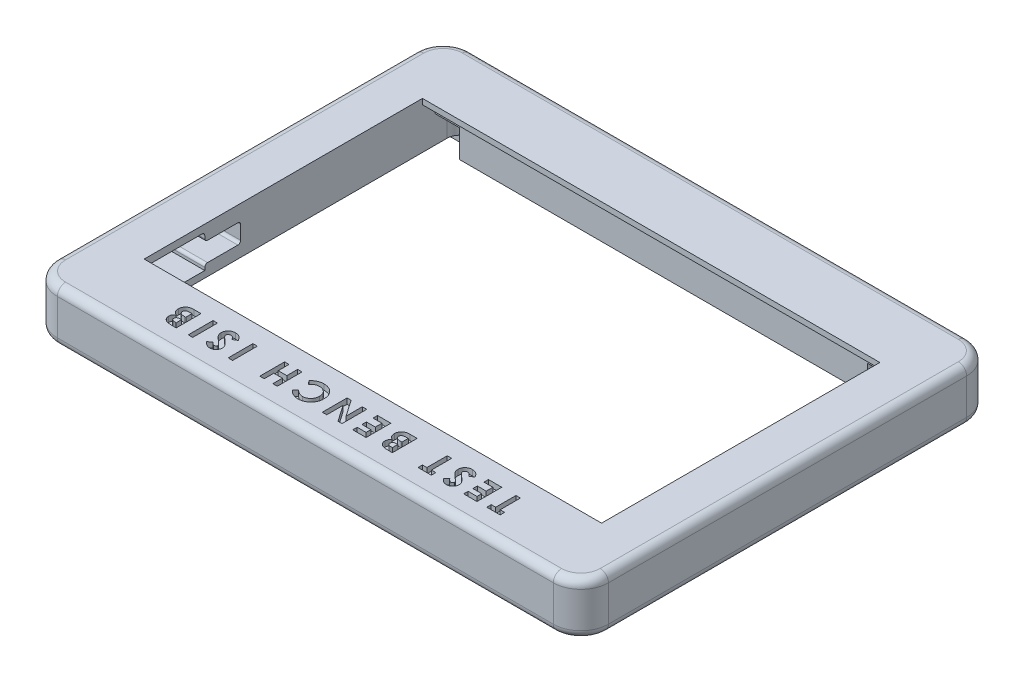
from build123d import *

# Parameters (mm, degrees)
BOSS_EXTRU_1_DEPTH        = 19
ESQUISSE3_W               = 170.2
ESQUISSE3_H               = 125
ENL_V_MAT_EXTRU_2_DEPTH   = 2
ESQUISSE2_W               = 166
ESQUISSE2_H               = 101
ENL_V_MAT_EXTRU_1_DEPTH   = 17
ENL_V_MAT_EXTRU_3_DEPTH   = 10
TROU_TARAUD_M3X0_51_D     = 2.5
TROU_TARAUD_M3X0_51_DEPTH = 11
TROU_TARAUD_M3X0_51_TIP   = 0.751075774
ESQUISSE9_W               = 1.614636752
ESQUISSE9_H               = 8.995833333
ENL_V_MAT_EXTRU_5_DEPTH   = 2
CONG_1_R                  = 3
ENL_V_MAT_EXTRU_6_REACH   = 200.683
ENL_V_MAT_EXTRU_7_DEPTH   = 5


with BuildPart() as part:
    # Esquisse1 → Boss.-Extru.1 (new body)
    with BuildSketch(Plane(origin=(0, 0, 0), x_dir=(1, 0, 0), z_dir=(0, 1, 0))):
        with BuildLine():
            Line((-90, 75), (90, 75))
            ThreePointArc((90, 75), (97.071067812, 72.071067812), (100, 65))
            Line((100, 65), (100, -65))
            ThreePointArc((100, -65), (97.071067812, -72.071067812), (90, -75))
            Line((90, -75), (-90, -75))
            ThreePointArc((-90, -75), (-97.071067812, -72.071067812), (-100, -65))
            Line((-100, -65), (-100, 65))
            ThreePointArc((-100, 65), (-97.071067812, 72.071067812), (-90, 75))
        make_face()
    extrude(amount=BOSS_EXTRU_1_DEPTH)

    # Esquisse3 → Enlèv. mat.-Extru.2 (cut)
    with BuildSketch(Plane.XZ):
        Rectangle(ESQUISSE3_W, ESQUISSE3_H)
    extrude(amount=-ENL_V_MAT_EXTRU_2_DEPTH, mode=Mode.SUBTRACT)

    # Esquisse2 → Enlèv. mat.-Extru.1 (cut)
    with BuildSketch(Plane(origin=(0, 19, 0), x_dir=(1, 0, 0), z_dir=(0, 1, 0))):
        Rectangle(ESQUISSE2_W, ESQUISSE2_H)
    extrude(amount=-ENL_V_MAT_EXTRU_1_DEPTH, mode=Mode.SUBTRACT)

    # Esquisse4 → Enlèv. mat.-Extru.3 (cut)
    with BuildSketch(Plane.XZ.offset(-2)):
        with BuildLine():
            Line((-83, -55), (-83, -59.5))
            ThreePointArc((-83, -59.5), (-78.5, -64), (-74, -59.5))
            Line((-74, -59.5), (-74, -55))
            Line((-74, -55), (74, -55))
            Line((74, -55), (74, -59.5))
            ThreePointArc((74, -59.5), (78.5, -64), (83, -59.5))
            Line((83, -59.5), (83, -55))
            Line((83, -55), (83, 52.5))
            Line((83, 52.5), (83, 57))
            ThreePointArc((83, 57), (78.5, 61.5), (74, 57))
            Line((74, 57), (74, 52.5))
            Line((74, 52.5), (-74, 52.5))
            Line((-74, 52.5), (-74, 57))
            ThreePointArc((-74, 57), (-78.5, 61.5), (-83, 57))
            Line((-83, 57), (-83, 52.5))
            Line((-83, 52.5), (-83, -55))
        make_face()
    extrude(amount=-ENL_V_MAT_EXTRU_3_DEPTH, mode=Mode.SUBTRACT)

    # Trou taraudé M3x0.51
    with Locations(Plane(origin=(0, 2, 0), x_dir=(-1, 0, 0), z_dir=(0, -1, 0))):
        with Locations((68.1, -59.2), (-68.1, -59.2), (-68.1, 59.2), (68.1, 59.2)):
            Hole(TROU_TARAUD_M3X0_51_D / 2, depth=TROU_TARAUD_M3X0_51_DEPTH)
            with Locations((0, 0, -(TROU_TARAUD_M3X0_51_DEPTH + TROU_TARAUD_M3X0_51_TIP / 2))):  # 118° drill point
                Cone(0, TROU_TARAUD_M3X0_51_D / 2, TROU_TARAUD_M3X0_51_TIP, mode=Mode.SUBTRACT)

    # Esquisse9 → Enlèv. mat.-Extru.5 (cut)
    # profile 1 of 13: a face of its own
    with BuildSketch(Plane(origin=(0, 19, 0), x_dir=(1, 0, 0), z_dir=(0, 1, 0))):
        with BuildLine():
            Line((-55.543504274, -57.318163919), (-55.543504274, -66.313997252))
            Line((-55.543504274, -66.313997252), (-56.985144231, -66.313997252))
            add(Edge.make_bspline(
                [(-56.985144231, -66.313997252), (-57.086068222, -66.31401103), (-57.281354231, -66.314037689), (-57.563098062, -66.304113358), (-57.823803469, -66.291445734), (-58.06378861, -66.276797649), (-58.282964639, -66.252487411), (-58.481482505, -66.226325004), (-58.65860696, -66.194983204), (-58.768112049, -66.166850461), (-58.819631076, -66.153614807)],
                knots=[0, 0, 0, 0, 1.311970222, 2.538637508, 3.664491357, 4.705491327, 5.663608299, 6.530571107, 7.308675535, 8, 8, 8, 8], degree=3))
            add(Edge.make_bspline(
                [(-58.819631076, -66.153614807), (-58.887280332, -66.134946334), (-59.020029888, -66.098312798), (-59.210179644, -66.024343182), (-59.390524584, -65.942070688), (-59.56102527, -65.848395845), (-59.719665235, -65.741571618), (-59.868619093, -65.623635486), (-60.007193969, -65.494547587), (-60.133181027, -65.353543067), (-60.246897462, -65.204336052), (-60.346107055, -65.046856999), (-60.431802102, -64.883601817), (-60.49760381, -64.711752985), (-60.552860568, -64.535798436), (-60.589828518, -64.352164176), (-60.614633195, -64.162432091), (-60.616917421, -64.033284972), (-60.618076923, -63.967728222)],
                knots=[0, 0, 0, 0, 1.099879008, 2.158315707, 3.195196496, 4.207130292, 5.205157476, 6.190838564, 7.183874245, 8.171129509, 9.152705923, 10.122275948, 11.08707516, 12.038677937, 13.004120747, 13.975884785, 14.972532894, 16, 16, 16, 16], degree=3))
            add(Edge.make_bspline(
                [(-60.618076923, -63.967728222), (-60.615263971, -63.883459518), (-60.609723697, -63.717487419), (-60.567206829, -63.474833215), (-60.498688402, -63.244223484), (-60.401865814, -63.023661559), (-60.271886711, -62.813481449), (-60.109799495, -62.609695995), (-59.911572488, -62.415087666), (-59.762043812, -62.295882731), (-59.684615051, -62.234156173)],
                knots=[0, 0, 0, 0, 0.986462413, 1.942894939, 2.875435142, 3.798266677, 4.755009598, 5.761362919, 6.840791609, 8, 8, 8, 8], degree=3))
            add(Edge.make_bspline(
                [(-59.684615051, -62.234156173), (-59.748046693, -62.201785113), (-59.872418593, -62.138314421), (-60.048880783, -62.033867901), (-60.212676488, -61.923227358), (-60.36266892, -61.806563398), (-60.502409579, -61.686192025), (-60.623222005, -61.55474029), (-60.737042067, -61.422354496), (-60.834486239, -61.280503077), (-60.918736373, -61.132216939), (-60.993477558, -60.979172659), (-61.054526617, -60.818326893), (-61.107078942, -60.651980302), (-61.146902385, -60.478414258), (-61.172658302, -60.298710882), (-61.192417642, -60.112975538), (-61.193952505, -59.986455275), (-61.194732906, -59.922126091)],
                knots=[0, 0, 0, 0, 1.164301211, 2.282872552, 3.350830854, 4.394111106, 5.389302619, 6.362088852, 7.310365691, 8.24222091, 9.170601078, 10.097577168, 11.024240953, 11.981127157, 12.948542686, 13.932080445, 14.948567018, 16, 16, 16, 16], degree=3))
            add(Edge.make_bspline(
                [(-61.194732906, -59.922126091), (-61.189921072, -59.799198084), (-61.18042015, -59.556477906), (-61.103540497, -59.201475497), (-60.980829063, -58.863185239), (-60.808772907, -58.547030156), (-60.599128444, -58.258620992), (-60.359078666, -58.003897675), (-60.088387873, -57.790582346), (-59.840319407, -57.645136026), (-59.624615908, -57.548155421), (-59.44521727, -57.4887323), (-59.252664646, -57.43365377), (-59.04480177, -57.39098221), (-58.822665319, -57.359187261), (-58.586356821, -57.336022811), (-58.33506127, -57.321413468), (-58.162504149, -57.319269001), (-58.073582399, -57.318163919)],
                knots=[0, 0, 0, 0, 1.284225818, 2.535691644, 3.779474941, 5.035581115, 6.285533147, 7.498311102, 8.683187976, 9.876672238, 10.49522506, 11.152635743, 11.850557634, 12.588370465, 13.369094102, 14.195874568, 15.07030211, 16, 16, 16, 16], degree=3))
            Line((-58.073582399, -57.318163919), (-55.543504274, -57.318163919))
        make_face()
        with BuildLine():
            Line((-57.158141026, -64.6993605), (-57.158141026, -62.738730158))
            Line((-57.158141026, -62.738730158), (-57.587028913, -62.738730158))
            add(Edge.make_bspline(
                [(-57.587028913, -62.738730158), (-57.645319354, -62.73923615), (-57.757845522, -62.740212936), (-57.92036593, -62.752882228), (-58.071525913, -62.774337464), (-58.211125484, -62.804907768), (-58.339980118, -62.84195132), (-58.456563743, -62.889067173), (-58.561254936, -62.945283758), (-58.684606855, -63.026980016), (-58.811666719, -63.15208778), (-58.92544207, -63.328686428), (-58.992122511, -63.533092991), (-58.999586088, -63.6771126), (-59.003440171, -63.751482228)],
                knots=[0, 0, 0, 0, 1.06517797, 2.056261606, 2.976983468, 3.853439442, 4.666321732, 5.424739265, 6.146762548, 6.834937974, 8.123729748, 9.372478121, 10.64318598, 12, 12, 12, 12], degree=3))
            add(Edge.make_bspline(
                [(-59.003440171, -63.751482228), (-59.00035734, -63.821145446), (-58.994396809, -63.955836478), (-58.927211814, -64.145083984), (-58.822550732, -64.311923983), (-58.700848342, -64.42776053), (-58.584796893, -64.505641409), (-58.48490019, -64.557571761), (-58.375117717, -64.603681655), (-58.252756333, -64.635879989), (-58.121482619, -64.666101472), (-57.978469114, -64.684477763), (-57.82516303, -64.698042091), (-57.719214328, -64.698911604), (-57.664517061, -64.6993605)],
                knots=[0, 0, 0, 0, 1.347812291, 2.605940898, 3.848830773, 5.144272192, 5.83350599, 6.558918059, 7.32804622, 8.140548749, 9.012446266, 9.943019774, 10.938059685, 12, 12, 12, 12], degree=3))
            Line((-57.664517061, -64.6993605), (-57.158141026, -64.6993605))
        make_face(mode=Mode.SUBTRACT)
        with BuildLine():
            Line((-57.158141026, -61.239424602), (-57.158141026, -58.932800671))
            Line((-57.158141026, -58.932800671), (-57.623069912, -58.932800671))
            add(Edge.make_bspline(
                [(-57.623069912, -58.932800671), (-57.714984684, -58.933335245), (-57.891702304, -58.934363031), (-58.14488591, -58.946437207), (-58.374968362, -58.968831609), (-58.582003801, -58.994978155), (-58.764297596, -59.036320165), (-58.925179047, -59.079305211), (-59.061860339, -59.134596063), (-59.176674039, -59.198713646), (-59.27269709, -59.27124212), (-59.355846428, -59.349736571), (-59.425199191, -59.437445995), (-59.480974254, -59.532430165), (-59.527827522, -59.633812623), (-59.556528806, -59.744958616), (-59.578278709, -59.86241165), (-59.579481014, -59.943639099), (-59.580096154, -59.98519784)],
                knots=[0, 0, 0, 0, 1.753677247, 3.371663338, 4.833688836, 6.164395063, 7.349095089, 8.3975697, 9.338276771, 10.154261968, 10.899224605, 11.628775934, 12.330426574, 13.024264642, 13.727131073, 14.452891561, 15.208446408, 16, 16, 16, 16], degree=3))
            add(Edge.make_bspline(
                [(-59.580096154, -59.98519784), (-59.578746218, -60.032723554), (-59.576116905, -60.125290859), (-59.554574932, -60.26056387), (-59.515600199, -60.386941311), (-59.465743244, -60.507700612), (-59.398432563, -60.619548334), (-59.316209349, -60.723229099), (-59.219804493, -60.81904852), (-59.108913507, -60.908459208), (-58.980161661, -60.98877317), (-58.830587313, -61.053730773), (-58.66405475, -61.112331105), (-58.477303766, -61.157629796), (-58.271796755, -61.196483104), (-58.045752365, -61.219585631), (-57.80113832, -61.236801988), (-57.631515185, -61.238530533), (-57.543779714, -61.239424602)],
                knots=[0, 0, 0, 0, 0.844862234, 1.645564352, 2.426138401, 3.19188377, 3.963047654, 4.738710309, 5.53926994, 6.37496817, 7.267116735, 8.227971149, 9.268346748, 10.402975021, 11.641070045, 12.984514716, 14.440277492, 16, 16, 16, 16], degree=3))
            Line((-57.543779714, -61.239424602), (-57.158141026, -61.239424602))
        make_face(mode=Mode.SUBTRACT)
    # profile 2 of 13: a face of its own
    with BuildSketch(Plane(origin=(0, 19, 0), x_dir=(1, 0, 0), z_dir=(0, 1, 0))):
        with Locations((-50.376666667, -61.816080586)):
            Rectangle(ESQUISSE9_W, ESQUISSE9_H)
    # profile 3 of 13: a face of its own
    with BuildSketch(Plane(origin=(0, 19, 0), x_dir=(1, 0, 0), z_dir=(0, 1, 0))):
        with BuildLine():
            Line((-45.671153846, -65.112029938), (-44.463780382, -64.00737332))
            add(Edge.make_bspline(
                [(-44.463780382, -64.00737332), (-44.412071632, -64.08034096), (-44.312798043, -64.220428651), (-44.151724161, -64.407804599), (-43.991612582, -64.568698841), (-43.829189661, -64.698511225), (-43.66725181, -64.803014284), (-43.502358574, -64.875094257), (-43.336406935, -64.921449319), (-43.224854495, -64.927193537), (-43.16990852, -64.930022893)],
                knots=[0, 0, 0, 0, 1.299459705, 2.494781419, 3.587730629, 4.594196874, 5.512431013, 6.380462003, 7.202284646, 8, 8, 8, 8], degree=3))
            add(Edge.make_bspline(
                [(-43.16990852, -64.930022893), (-43.118635498, -64.928279076), (-43.019640764, -64.924912224), (-42.879173772, -64.889761896), (-42.752940449, -64.832960858), (-42.64430331, -64.754499286), (-42.556907095, -64.660793402), (-42.488951318, -64.561038914), (-42.449462084, -64.452273676), (-42.444390886, -64.377680572), (-42.441880342, -64.34075256)],
                knots=[0, 0, 0, 0, 1.184157716, 2.286297433, 3.324836695, 4.370048774, 5.362957217, 6.276446515, 7.146738784, 8, 8, 8, 8], degree=3))
            add(Edge.make_bspline(
                [(-42.441880342, -64.34075256), (-42.443469513, -64.303309364), (-42.446669882, -64.227903969), (-42.477581092, -64.117387973), (-42.524173111, -64.009400979), (-42.568693687, -63.943664158), (-42.591450487, -63.910062623)],
                knots=[0, 0, 0, 0, 0.967525499, 1.948461899, 2.951351359, 4, 4, 4, 4], degree=3))
            add(Edge.make_bspline(
                [(-42.591450487, -63.910062623), (-42.612222308, -63.884022204), (-42.660312573, -63.823734245), (-42.749224066, -63.726722567), (-42.865481193, -63.612836254), (-43.004170237, -63.476336894), (-43.170495935, -63.322526612), (-43.360887197, -63.146952001), (-43.579580012, -62.955577204), (-43.732796652, -62.820475323), (-43.813240351, -62.749542458)],
                knots=[0, 0, 0, 0, 0.473849886, 1.097042329, 1.870584189, 2.789244661, 3.865562256, 5.093556389, 6.47402294, 8, 8, 8, 8], degree=3))
            add(Edge.make_bspline(
                [(-43.813240351, -62.749542458), (-43.888929267, -62.684071003), (-44.032571103, -62.559819785), (-44.236685889, -62.383175119), (-44.417236734, -62.224965492), (-44.5725816, -62.084006182), (-44.707362557, -61.966102072), (-44.815618556, -61.86399954), (-44.901982727, -61.782165128), (-44.951027456, -61.732680456), (-44.971958467, -61.711561688)],
                knots=[0, 0, 0, 0, 1.543627419, 2.929484142, 4.163674036, 5.24627963, 6.164986907, 6.925413438, 7.541394495, 8, 8, 8, 8], degree=3))
            add(Edge.make_bspline(
                [(-44.971958467, -61.711561688), (-45.051415321, -61.625639853), (-45.2041593, -61.460467911), (-45.402283493, -61.203810425), (-45.567103667, -60.955197336), (-45.694740017, -60.707608221), (-45.787307544, -60.455926414), (-45.854693421, -60.196561038), (-45.89508475, -59.925803686), (-45.899555149, -59.741455995), (-45.901816239, -59.6482145)],
                knots=[0, 0, 0, 0, 1.206413378, 2.319150186, 3.339784753, 4.27899982, 5.184598145, 6.099639703, 7.038813909, 8, 8, 8, 8], degree=3))
            add(Edge.make_bspline(
                [(-45.901816239, -59.6482145), (-45.900204874, -59.557361351), (-45.897043315, -59.379104091), (-45.858362217, -59.11823904), (-45.803126398, -58.868626168), (-45.718014512, -58.632766094), (-45.613405303, -58.407863682), (-45.485911903, -58.193843304), (-45.330038481, -57.995701479), (-45.156908542, -57.808091795), (-44.962415318, -57.639692548), (-44.753272476, -57.491226884), (-44.529081727, -57.365873605), (-44.291551566, -57.262569584), (-44.037702983, -57.185906597), (-43.771546172, -57.127944912), (-43.4903995, -57.092996755), (-43.298554177, -57.089359661), (-43.200543369, -57.087501525)],
                knots=[0, 0, 0, 0, 1.043039441, 2.046482205, 3.024244422, 3.976033659, 4.920890471, 5.871402525, 6.830893638, 7.812473116, 8.800703348, 9.781190227, 10.754606487, 11.746997808, 12.751247331, 13.796362838, 14.874195872, 16, 16, 16, 16], degree=3))
            add(Edge.make_bspline(
                [(-43.200543369, -57.087501525), (-43.12360459, -57.088864982), (-42.971221683, -57.091565409), (-42.746642922, -57.113657433), (-42.529746102, -57.149199233), (-42.320964431, -57.200533671), (-42.118977238, -57.264094378), (-41.92597653, -57.34674601), (-41.739396245, -57.440214078), (-41.559856868, -57.548528432), (-41.388846149, -57.674325042), (-41.221436955, -57.812638793), (-41.063564106, -57.971055601), (-40.909195711, -58.143800326), (-40.764778956, -58.335879523), (-40.622703856, -58.541513351), (-40.48990469, -58.765617614), (-40.407837104, -58.922796919), (-40.365918803, -59.003080619)],
                knots=[0, 0, 0, 0, 1.017088714, 2.014418954, 2.980620591, 3.920647918, 4.854987948, 5.776890852, 6.693269322, 7.612671471, 8.545186947, 9.498010697, 10.480815007, 11.499174288, 12.558697099, 13.655746277, 14.802607237, 16, 16, 16, 16], degree=3))
            Line((-40.365918803, -59.003080619), (-41.785934161, -59.855450243))
            add(Edge.make_bspline(
                [(-41.785934161, -59.855450243), (-41.838363962, -59.764314706), (-41.938876369, -59.589600091), (-42.109204041, -59.354848862), (-42.283696046, -59.153823293), (-42.466386481, -58.990076523), (-42.655053901, -58.861419048), (-42.850609612, -58.769471491), (-43.053191008, -58.712556058), (-43.191180251, -58.705605369), (-43.260011018, -58.702138278)],
                knots=[0, 0, 0, 0, 1.283663364, 2.460892379, 3.537111102, 4.529833553, 5.449777664, 6.316464042, 7.160231139, 8, 8, 8, 8], degree=3))
            add(Edge.make_bspline(
                [(-43.260011018, -58.702138278), (-43.330034654, -58.704942787), (-43.465890708, -58.710383943), (-43.660127074, -58.761634117), (-43.838990801, -58.840296375), (-43.992768184, -58.954698534), (-44.123354744, -59.085150271), (-44.216971887, -59.232279288), (-44.277698057, -59.389558385), (-44.284006634, -59.49930942), (-44.287179487, -59.554507902)],
                knots=[0, 0, 0, 0, 1.13537643, 2.202795631, 3.242191317, 4.290390765, 5.297919085, 6.223733717, 7.106639842, 8, 8, 8, 8], degree=3))
            add(Edge.make_bspline(
                [(-44.287179487, -59.554507902), (-44.284209606, -59.605835333), (-44.278176577, -59.710102096), (-44.233980989, -59.865220006), (-44.164310033, -60.019585755), (-44.084354426, -60.147540769), (-44.000996401, -60.254196595), (-43.919289567, -60.345219489), (-43.822452837, -60.447887915), (-43.708018758, -60.559402215), (-43.578213053, -60.681906454), (-43.432610765, -60.81510937), (-43.269643895, -60.95792516), (-43.15445396, -61.055205892), (-43.094222423, -61.106072906)],
                knots=[0, 0, 0, 0, 0.916057066, 1.860882232, 2.859899639, 3.934694552, 4.546382938, 5.276161949, 6.118633209, 7.067046139, 8.129668089, 9.306861125, 10.591787583, 12, 12, 12, 12], degree=3))
            add(Edge.make_bspline(
                [(-43.094222423, -61.106072906), (-42.979724159, -61.202955776), (-42.759967336, -61.388903327), (-42.449367613, -61.663487629), (-42.169684301, -61.92030293), (-41.922782677, -62.16140378), (-41.707929319, -62.385249692), (-41.522758995, -62.589875518), (-41.37026396, -62.77929394), (-41.212135966, -63.005531818), (-41.057640279, -63.277329868), (-40.926340935, -63.605870536), (-40.841484346, -63.933999851), (-40.831940836, -64.154658058), (-40.82724359, -64.263264413)],
                knots=[0, 0, 0, 0, 1.345685333, 2.582777463, 3.719355561, 4.752181389, 5.678433858, 6.502864483, 7.227563063, 7.858499643, 8.978226409, 10.023061349, 11.026965269, 12, 12, 12, 12], degree=3))
            add(Edge.make_bspline(
                [(-40.82724359, -64.263264413), (-40.829198084, -64.340280396), (-40.833048649, -64.492010157), (-40.867294576, -64.715132825), (-40.918714447, -64.930325696), (-40.99260798, -65.13753432), (-41.091719447, -65.334424391), (-41.208788246, -65.524182615), (-41.347147873, -65.706229), (-41.5057227, -65.876525221), (-41.679794214, -66.033070274), (-41.865458409, -66.170413771), (-42.060999909, -66.286550998), (-42.267011686, -66.381163028), (-42.483129203, -66.45499344), (-42.709552074, -66.507170587), (-42.945586425, -66.538285873), (-43.106141735, -66.542508585), (-43.18792902, -66.544659645)],
                knots=[0, 0, 0, 0, 1.010806554, 1.991397492, 2.957573065, 3.913225829, 4.872777376, 5.846906201, 6.837692339, 7.870332167, 8.898170327, 9.907899016, 10.8981826, 11.879407896, 12.8797257, 13.891947133, 14.926152479, 16, 16, 16, 16], degree=3))
            add(Edge.make_bspline(
                [(-43.18792902, -66.544659645), (-43.293915015, -66.540771893), (-43.505050388, -66.533027077), (-43.817312521, -66.472781014), (-44.122467287, -66.37703818), (-44.369128214, -66.264257423), (-44.563703223, -66.151523667), (-44.7131893, -66.04983849), (-44.866485672, -65.933069018), (-45.020778082, -65.797817171), (-45.181917339, -65.651901353), (-45.341764183, -65.485307888), (-45.508146106, -65.306572551), (-45.615866052, -65.178013504), (-45.671153846, -65.112029938)],
                knots=[0, 0, 0, 0, 1.282890948, 2.555655204, 3.837225328, 5.149160694, 5.83044799, 6.558852598, 7.337307105, 8.162686284, 9.043076448, 9.969084596, 10.957622644, 12, 12, 12, 12], degree=3))
        make_face()
    # profile 4 of 13: a face of its own
    with BuildSketch(Plane(origin=(0, 19, 0), x_dir=(1, 0, 0), z_dir=(0, 1, 0))):
        with Locations((-35.891068376, -61.816080586)):
            Rectangle(ESQUISSE9_W, ESQUISSE9_H)
    # profile 5 of 13: a face of its own
    with BuildSketch(Plane(origin=(0, 19, 0), x_dir=(1, 0, 0), z_dir=(0, 1, 0))):
        Polygon((-18.868183761, -66.313997252), (-20.482820513, -66.313997252), (-20.482820513, -62.854061355), (-23.596762821, -62.854061355), (-23.596762821, -66.313997252), (-25.211399573, -66.313997252), (-25.211399573, -57.318163919), (-23.596762821, -57.318163919), (-23.596762821, -61.239424602), (-20.482820513, -61.239424602), (-20.482820513, -57.318163919), (-18.868183761, -57.318163919), align=None)
    # profile 6 of 13: a face of its own
    with BuildSketch(Plane(origin=(0, 19, 0), x_dir=(1, 0, 0), z_dir=(0, 1, 0))):
        with BuildLine():
            Line((-14.969989316, -64.753421998), (-13.786042501, -63.621734632))
            add(Edge.make_bspline(
                [(-13.786042501, -63.621734632), (-13.685727387, -63.725732866), (-13.489461566, -63.929204684), (-13.171699652, -64.195571449), (-12.845027362, -64.421949768), (-12.508530351, -64.606464191), (-12.162401919, -64.75289632), (-11.806039866, -64.85504731), (-11.440304995, -64.919367622), (-11.193157743, -64.926451399), (-11.068551182, -64.930022893)],
                knots=[0, 0, 0, 0, 1.115370381, 2.182214363, 3.196266025, 4.180416361, 5.141116029, 6.092551847, 7.038303877, 8, 8, 8, 8], degree=3))
            add(Edge.make_bspline(
                [(-11.068551182, -64.930022893), (-10.964503391, -64.927145966), (-10.759176539, -64.921468669), (-10.457731401, -64.879748181), (-10.16927422, -64.809068282), (-9.89357614, -64.710823737), (-9.62927408, -64.587100912), (-9.378829161, -64.431590242), (-9.140895467, -64.249482081), (-8.918253055, -64.0410951), (-8.717255118, -63.811732287), (-8.536153121, -63.570172129), (-8.386147595, -63.312142013), (-8.263698253, -63.041404807), (-8.167205357, -62.757862748), (-8.098720476, -62.461530028), (-8.059040291, -62.151737581), (-8.053124235, -61.941135339), (-8.050117521, -61.834101085)],
                knots=[0, 0, 0, 0, 1.035268443, 2.04298821, 3.02163646, 3.985902049, 4.951223231, 5.920091634, 6.913651787, 7.92868536, 8.949353712, 9.945284791, 10.92850487, 11.913014323, 12.897904816, 13.904240668, 14.934873455, 16, 16, 16, 16], degree=3))
            add(Edge.make_bspline(
                [(-8.050117521, -61.834101085), (-8.050996392, -61.75897916), (-8.052728663, -61.610912303), (-8.07121302, -61.392443077), (-8.101911067, -61.180017914), (-8.144967505, -60.974266202), (-8.199171896, -60.774300375), (-8.26551291, -60.581422916), (-8.345725571, -60.395386359), (-8.43549686, -60.215216192), (-8.535700797, -60.042439078), (-8.648024813, -59.879346221), (-8.771210236, -59.727204919), (-8.900327979, -59.580721185), (-9.043929222, -59.448467467), (-9.195584433, -59.323155076), (-9.357469574, -59.207888445), (-9.529388049, -59.104271669), (-9.70620829, -59.007702632), (-9.891553616, -58.927731031), (-10.080244753, -58.855841323), (-10.275591977, -58.801758632), (-10.474154257, -58.754718124), (-10.678695396, -58.725989022), (-10.887274222, -58.704158704), (-11.028244705, -58.702814652), (-11.099186031, -58.702138278)],
                knots=[0, 0, 0, 0, 1.103833241, 2.175677997, 3.219414644, 4.256521947, 5.263082927, 6.262573145, 7.25136242, 8.238376666, 9.219530388, 10.184343756, 11.145312504, 12.095474572, 13.051075647, 14.010745898, 14.985684176, 15.968306307, 16.959653902, 17.943861036, 18.93268972, 19.924626761, 20.920484516, 21.929288403, 22.957944781, 24, 24, 24, 24], degree=3))
            add(Edge.make_bspline(
                [(-11.099186031, -58.702138278), (-11.219516812, -58.70561093), (-11.455935506, -58.712433788), (-11.802862804, -58.766020498), (-12.134401705, -58.853770905), (-12.398780175, -58.959317439), (-12.605643765, -59.061923748), (-12.763045084, -59.155473063), (-12.92512281, -59.261438072), (-13.09076725, -59.382754175), (-13.260875051, -59.517977651), (-13.432523902, -59.669934841), (-13.610084461, -59.833660987), (-13.726403551, -59.950513891), (-13.786042501, -60.010426539)],
                knots=[0, 0, 0, 0, 1.404640003, 2.759752344, 4.088613405, 5.401587939, 6.076032573, 6.783413463, 7.538272532, 8.336594406, 9.180107851, 10.074881764, 11.012956238, 12, 12, 12, 12], degree=3))
            Line((-13.786042501, -60.010426539), (-14.933948317, -58.804855125))
            add(Edge.make_bspline(
                [(-14.933948317, -58.804855125), (-14.853256718, -58.726949915), (-14.695763973, -58.574895606), (-14.458190522, -58.358992727), (-14.22091613, -58.164979799), (-13.98967257, -57.985815888), (-13.760672815, -57.826717426), (-13.533937746, -57.687536157), (-13.312045958, -57.564714726), (-13.090348098, -57.46045382), (-12.867084312, -57.371360476), (-12.637466157, -57.296223552), (-12.401383918, -57.230634168), (-12.156882353, -57.179018705), (-11.905052405, -57.137000146), (-11.645084854, -57.109235207), (-11.378194354, -57.089981969), (-11.197733687, -57.088335088), (-11.106394231, -57.087501525)],
                knots=[0, 0, 0, 0, 1.244537013, 2.429070097, 3.56066612, 4.644477994, 5.67429546, 6.652817684, 7.595405349, 8.486886006, 9.369351459, 10.26090686, 11.166404474, 12.086719576, 13.0323422, 13.998023148, 14.9867073, 16, 16, 16, 16], degree=3))
            add(Edge.make_bspline(
                [(-11.106394231, -57.087501525), (-10.938621431, -57.091785947), (-10.610336698, -57.10016937), (-10.129197598, -57.162071021), (-9.671749171, -57.266533211), (-9.23716945, -57.412264496), (-8.826788432, -57.601495795), (-8.439319154, -57.831106234), (-8.075406873, -58.103275063), (-7.738183017, -58.413947217), (-7.433243568, -58.757130715), (-7.163407716, -59.12547444), (-6.941181207, -59.521623564), (-6.752633436, -59.937092318), (-6.611345524, -60.37837608), (-6.508500376, -60.841487345), (-6.44591964, -61.328413481), (-6.43900651, -61.660917684), (-6.435480769, -61.830496985)],
                knots=[0, 0, 0, 0, 1.07798487, 2.109316747, 3.111276023, 4.08905949, 5.049398091, 6.009992678, 6.978127636, 7.964347882, 8.951383687, 9.924270623, 10.892397886, 11.86520058, 12.851549246, 13.863953586, 14.910602472, 16, 16, 16, 16], degree=3))
            add(Edge.make_bspline(
                [(-6.435480769, -61.830496985), (-6.437020624, -61.941090453), (-6.440072239, -62.160259676), (-6.470156086, -62.483950937), (-6.516306019, -62.798182393), (-6.58198821, -63.102567565), (-6.663655297, -63.398160372), (-6.767605689, -63.683622462), (-6.888006936, -63.960516554), (-7.028574091, -64.226262229), (-7.186142369, -64.481195307), (-7.358407108, -64.724671401), (-7.548685566, -64.954268766), (-7.755169567, -65.170991595), (-7.976143029, -65.376240633), (-8.213767062, -65.568559211), (-8.468268877, -65.746707113), (-8.737052471, -65.910830751), (-9.015000795, -66.061555656), (-9.302311382, -66.187938115), (-9.593385105, -66.299503177), (-9.890194151, -66.389616714), (-10.193391802, -66.457589579), (-10.500662774, -66.508884089), (-10.814517678, -66.537592492), (-11.025247785, -66.54228892), (-11.13162293, -66.544659645)],
                knots=[0, 0, 0, 0, 1.07193642, 2.124315995, 3.14887099, 4.149444713, 5.141371803, 6.119544533, 7.092241254, 8.06650569, 9.031360777, 9.996057679, 10.955696533, 11.919602115, 12.89624813, 13.877605408, 14.880920851, 15.905674436, 16.929600311, 17.943674756, 18.946313929, 19.950355855, 20.947755382, 21.956851243, 22.968632213, 24, 24, 24, 24], degree=3))
            add(Edge.make_bspline(
                [(-11.13162293, -66.544659645), (-11.222371148, -66.543298979), (-11.402924055, -66.540591794), (-11.671805042, -66.518064347), (-11.93850621, -66.48258477), (-12.202213139, -66.42942771), (-12.464111703, -66.365052064), (-12.723105403, -66.285758646), (-12.978480055, -66.189039261), (-13.232449556, -66.08204721), (-13.479948864, -65.960242315), (-13.718827039, -65.823905603), (-13.949675981, -65.676603771), (-14.171104055, -65.515803207), (-14.384670872, -65.34386586), (-14.590148561, -65.160797422), (-14.785565409, -64.963277079), (-14.908203901, -64.823727326), (-14.969989316, -64.753421998)],
                knots=[0, 0, 0, 0, 0.996333415, 1.982307736, 2.96084097, 3.949129141, 4.93457382, 5.921430247, 6.92116383, 7.931890485, 8.946633814, 9.948019707, 10.950686436, 11.952094051, 12.951305284, 13.960287133, 14.972390273, 16, 16, 16, 16], degree=3))
        make_face()
    # profile 7 of 13: a face of its own
    with BuildSketch(Plane(origin=(0, 19, 0), x_dir=(1, 0, 0), z_dir=(0, 1, 0))):
        Polygon((4.613247863, -66.313997252), (3.158993556, -66.313997252), (-0.922649573, -60.394263177), (-0.922649573, -66.313997252), (-2.537286325, -66.313997252), (-2.537286325, -57.318163919), (-1.072219718, -57.318163919), (2.998611111, -63.219877494), (2.998611111, -57.318163919), (4.613247863, -57.318163919), align=None)
    # profile 8 of 13: a face of its own
    with BuildSketch(Plane(origin=(0, 19, 0), x_dir=(1, 0, 0), z_dir=(0, 1, 0))):
        Polygon((13.355352564, -66.313997252), (8.511442308, -66.313997252), (8.511442308, -64.6993605), (11.740715812, -64.6993605), (11.740715812, -62.969392551), (8.511442308, -62.969392551), (8.511442308, -61.354755799), (11.740715812, -61.354755799), (11.740715812, -58.932800671), (8.511442308, -58.932800671), (8.511442308, -57.318163919), (13.355352564, -57.318163919), align=None)
    # profile 9 of 13: a face of its own
    with BuildSketch(Plane(origin=(0, 19, 0), x_dir=(1, 0, 0), z_dir=(0, 1, 0))):
        with BuildLine():
            Line((22.904775641, -57.318163919), (22.904775641, -66.313997252))
            Line((22.904775641, -66.313997252), (21.463135684, -66.313997252))
            add(Edge.make_bspline(
                [(21.463135684, -66.313997252), (21.362211693, -66.31401103), (21.166925684, -66.314037689), (20.885181852, -66.304113358), (20.624476445, -66.291445734), (20.384491305, -66.276797649), (20.165315276, -66.252487411), (19.966797409, -66.226325004), (19.789672955, -66.194983204), (19.680167865, -66.166850461), (19.628648838, -66.153614807)],
                knots=[0, 0, 0, 0, 1.311970222, 2.538637508, 3.664491357, 4.705491327, 5.663608299, 6.530571107, 7.308675535, 8, 8, 8, 8], degree=3))
            add(Edge.make_bspline(
                [(19.628648838, -66.153614807), (19.560999583, -66.134946334), (19.428250027, -66.098312798), (19.23810027, -66.024343182), (19.05775533, -65.942070688), (18.887254644, -65.848395845), (18.72861468, -65.741571618), (18.579660822, -65.623635486), (18.441085946, -65.494547587), (18.315098888, -65.353543067), (18.201382452, -65.204336052), (18.102172859, -65.046856999), (18.016477813, -64.883601817), (17.950676105, -64.711752985), (17.895419346, -64.535798436), (17.858451396, -64.352164176), (17.833646719, -64.162432091), (17.831362494, -64.033284972), (17.830202991, -63.967728222)],
                knots=[0, 0, 0, 0, 1.099879008, 2.158315707, 3.195196496, 4.207130292, 5.205157476, 6.190838564, 7.183874245, 8.171129509, 9.152705923, 10.122275948, 11.08707516, 12.038677937, 13.004120747, 13.975884785, 14.972532894, 16, 16, 16, 16], degree=3))
            add(Edge.make_bspline(
                [(17.830202991, -63.967728222), (17.833015944, -63.883459518), (17.838556217, -63.717487419), (17.881073086, -63.474833215), (17.949591513, -63.244223484), (18.0464141, -63.023661559), (18.176393203, -62.813481449), (18.338480419, -62.609695995), (18.536707427, -62.415087666), (18.686236103, -62.295882731), (18.763664864, -62.234156173)],
                knots=[0, 0, 0, 0, 0.986462413, 1.942894939, 2.875435142, 3.798266677, 4.755009598, 5.761362919, 6.840791609, 8, 8, 8, 8], degree=3))
            add(Edge.make_bspline(
                [(18.763664864, -62.234156173), (18.700233222, -62.201785113), (18.575861322, -62.138314421), (18.399399131, -62.033867901), (18.235603427, -61.923227358), (18.085610995, -61.806563398), (17.945870335, -61.686192025), (17.82505791, -61.55474029), (17.711237847, -61.422354496), (17.613793676, -61.280503077), (17.529543542, -61.132216939), (17.454802357, -60.979172659), (17.393753298, -60.818326893), (17.341200973, -60.651980302), (17.301377529, -60.478414258), (17.275621613, -60.298710882), (17.255862273, -60.112975538), (17.254327409, -59.986455275), (17.253547009, -59.922126091)],
                knots=[0, 0, 0, 0, 1.164301211, 2.282872552, 3.350830854, 4.394111106, 5.389302619, 6.362088852, 7.310365691, 8.24222091, 9.170601078, 10.097577168, 11.024240953, 11.981127157, 12.948542686, 13.932080445, 14.948567018, 16, 16, 16, 16], degree=3))
            add(Edge.make_bspline(
                [(17.253547009, -59.922126091), (17.258358843, -59.799198084), (17.267859764, -59.556477906), (17.344739417, -59.201475497), (17.467450852, -58.863185239), (17.639507008, -58.547030156), (17.84915147, -58.258620992), (18.089201248, -58.003897675), (18.359892041, -57.790582346), (18.607960508, -57.645136026), (18.823664006, -57.548155421), (19.003062645, -57.4887323), (19.195615268, -57.43365377), (19.403478145, -57.39098221), (19.625614596, -57.359187261), (19.861923094, -57.336022811), (20.113218645, -57.321413468), (20.285775766, -57.319269001), (20.374697516, -57.318163919)],
                knots=[0, 0, 0, 0, 1.284225818, 2.535691644, 3.779474941, 5.035581115, 6.285533147, 7.498311102, 8.683187976, 9.876672238, 10.49522506, 11.152635743, 11.850557634, 12.588370465, 13.369094102, 14.195874568, 15.07030211, 16, 16, 16, 16], degree=3))
            Line((20.374697516, -57.318163919), (22.904775641, -57.318163919))
        make_face()
        with BuildLine():
            Line((21.290138889, -64.6993605), (21.290138889, -62.738730158))
            Line((21.290138889, -62.738730158), (20.861251002, -62.738730158))
            add(Edge.make_bspline(
                [(20.861251002, -62.738730158), (20.802960561, -62.73923615), (20.690434393, -62.740212936), (20.527913984, -62.752882228), (20.376754002, -62.774337464), (20.237154431, -62.804907768), (20.108299797, -62.84195132), (19.991716172, -62.889067173), (19.887024979, -62.945283758), (19.76367306, -63.026980016), (19.636613196, -63.15208778), (19.522837845, -63.328686428), (19.456157403, -63.533092991), (19.448693826, -63.6771126), (19.444839744, -63.751482228)],
                knots=[0, 0, 0, 0, 1.06517797, 2.056261606, 2.976983468, 3.853439442, 4.666321732, 5.424739265, 6.146762548, 6.834937974, 8.123729748, 9.372478121, 10.64318598, 12, 12, 12, 12], degree=3))
            add(Edge.make_bspline(
                [(19.444839744, -63.751482228), (19.447922575, -63.821145446), (19.453883105, -63.955836478), (19.5210681, -64.145083984), (19.625729182, -64.311923983), (19.747431572, -64.42776053), (19.863483022, -64.505641409), (19.963379724, -64.557571761), (20.073162198, -64.603681655), (20.195523581, -64.635879989), (20.326797295, -64.666101472), (20.4698108, -64.684477763), (20.623116885, -64.698042091), (20.729065586, -64.698911604), (20.783762854, -64.6993605)],
                knots=[0, 0, 0, 0, 1.347812291, 2.605940898, 3.848830773, 5.144272192, 5.83350599, 6.558918059, 7.32804622, 8.140548749, 9.012446266, 9.943019774, 10.938059685, 12, 12, 12, 12], degree=3))
            Line((20.783762854, -64.6993605), (21.290138889, -64.6993605))
        make_face(mode=Mode.SUBTRACT)
        with BuildLine():
            Line((21.290138889, -61.239424602), (21.290138889, -58.932800671))
            Line((21.290138889, -58.932800671), (20.825210003, -58.932800671))
            add(Edge.make_bspline(
                [(20.825210003, -58.932800671), (20.73329523, -58.933335245), (20.556577611, -58.934363031), (20.303394004, -58.946437207), (20.073311552, -58.968831609), (19.866276113, -58.994978155), (19.683982319, -59.036320165), (19.523100868, -59.079305211), (19.386419575, -59.134596063), (19.271605875, -59.198713646), (19.175582824, -59.27124212), (19.092433487, -59.349736571), (19.023080723, -59.437445995), (18.96730566, -59.532430165), (18.920452392, -59.633812623), (18.891751109, -59.744958616), (18.870001205, -59.86241165), (18.868798901, -59.943639099), (18.868183761, -59.98519784)],
                knots=[0, 0, 0, 0, 1.753677247, 3.371663338, 4.833688836, 6.164395063, 7.349095089, 8.3975697, 9.338276771, 10.154261968, 10.899224605, 11.628775934, 12.330426574, 13.024264642, 13.727131073, 14.452891561, 15.208446408, 16, 16, 16, 16], degree=3))
            add(Edge.make_bspline(
                [(18.868183761, -59.98519784), (18.869533697, -60.032723554), (18.872163009, -60.125290859), (18.893704983, -60.26056387), (18.932679715, -60.386941311), (18.98253667, -60.507700612), (19.049847352, -60.619548334), (19.132070566, -60.723229099), (19.228475421, -60.81904852), (19.339366407, -60.908459208), (19.468118254, -60.98877317), (19.617692601, -61.053730773), (19.784225165, -61.112331105), (19.970976149, -61.157629796), (20.17648316, -61.196483104), (20.40252755, -61.219585631), (20.647141594, -61.236801988), (20.816764729, -61.238530533), (20.9045002, -61.239424602)],
                knots=[0, 0, 0, 0, 0.844862234, 1.645564352, 2.426138401, 3.19188377, 3.963047654, 4.738710309, 5.53926994, 6.37496817, 7.267116735, 8.227971149, 9.268346748, 10.402975021, 11.641070045, 12.984514716, 14.440277492, 16, 16, 16, 16], degree=3))
            Line((20.9045002, -61.239424602), (21.290138889, -61.239424602))
        make_face(mode=Mode.SUBTRACT)
    # profile 10 of 13: a face of its own
    with BuildSketch(Plane(origin=(0, 19, 0), x_dir=(1, 0, 0), z_dir=(0, 1, 0))):
        Polygon((37.044380342, -66.313997252), (32.200470085, -66.313997252), (32.200470085, -64.6993605), (33.815106838, -64.6993605), (33.815106838, -57.318163919), (35.42974359, -57.318163919), (35.42974359, -64.6993605), (37.044380342, -64.6993605), align=None)
    # profile 11 of 13: a face of its own
    with BuildSketch(Plane(origin=(0, 19, 0), x_dir=(1, 0, 0), z_dir=(0, 1, 0))):
        with BuildLine():
            Line((40.250587607, -65.112029938), (41.457961071, -64.00737332))
            add(Edge.make_bspline(
                [(41.457961071, -64.00737332), (41.509669821, -64.08034096), (41.60894341, -64.220428651), (41.770017292, -64.407804599), (41.930128871, -64.568698841), (42.092551792, -64.698511225), (42.254489643, -64.803014284), (42.419382879, -64.875094257), (42.585334518, -64.921449319), (42.696886958, -64.927193537), (42.751832933, -64.930022893)],
                knots=[0, 0, 0, 0, 1.299459705, 2.494781419, 3.587730629, 4.594196874, 5.512431013, 6.380462003, 7.202284646, 8, 8, 8, 8], degree=3))
            add(Edge.make_bspline(
                [(42.751832933, -64.930022893), (42.803105955, -64.928279076), (42.902100689, -64.924912224), (43.042567681, -64.889761896), (43.168801004, -64.832960858), (43.277438143, -64.754499286), (43.364834358, -64.660793402), (43.432790135, -64.561038914), (43.472279369, -64.452273676), (43.477350567, -64.377680572), (43.479861111, -64.34075256)],
                knots=[0, 0, 0, 0, 1.184157716, 2.286297433, 3.324836695, 4.370048774, 5.362957217, 6.276446515, 7.146738784, 8, 8, 8, 8], degree=3))
            add(Edge.make_bspline(
                [(43.479861111, -64.34075256), (43.47827194, -64.303309364), (43.475071571, -64.227903969), (43.444160361, -64.117387973), (43.397568342, -64.009400979), (43.353047766, -63.943664158), (43.330290966, -63.910062623)],
                knots=[0, 0, 0, 0, 0.967525499, 1.948461899, 2.951351359, 4, 4, 4, 4], degree=3))
            add(Edge.make_bspline(
                [(43.330290966, -63.910062623), (43.309519145, -63.884022204), (43.26142888, -63.823734245), (43.172517386, -63.726722567), (43.05626026, -63.612836254), (42.917571216, -63.476336894), (42.751245518, -63.322526612), (42.560854256, -63.146952001), (42.342161441, -62.955577204), (42.188944801, -62.820475323), (42.108501102, -62.749542458)],
                knots=[0, 0, 0, 0, 0.473849886, 1.097042329, 1.870584189, 2.789244661, 3.865562256, 5.093556389, 6.47402294, 8, 8, 8, 8], degree=3))
            add(Edge.make_bspline(
                [(42.108501102, -62.749542458), (42.032812186, -62.684071003), (41.88917035, -62.559819785), (41.685055564, -62.383175119), (41.504504719, -62.224965492), (41.349159853, -62.084006182), (41.214378896, -61.966102072), (41.106122897, -61.86399954), (41.019758726, -61.782165128), (40.970713997, -61.732680456), (40.949782986, -61.711561688)],
                knots=[0, 0, 0, 0, 1.543627419, 2.929484142, 4.163674036, 5.24627963, 6.164986907, 6.925413438, 7.541394495, 8, 8, 8, 8], degree=3))
            add(Edge.make_bspline(
                [(40.949782986, -61.711561688), (40.870326132, -61.625639853), (40.717582153, -61.460467911), (40.51945796, -61.203810425), (40.354637786, -60.955197336), (40.227001436, -60.707608221), (40.134433909, -60.455926414), (40.067048032, -60.196561038), (40.026656703, -59.925803686), (40.022186304, -59.741455995), (40.019925214, -59.6482145)],
                knots=[0, 0, 0, 0, 1.206413378, 2.319150186, 3.339784753, 4.27899982, 5.184598145, 6.099639703, 7.038813909, 8, 8, 8, 8], degree=3))
            add(Edge.make_bspline(
                [(40.019925214, -59.6482145), (40.021536579, -59.557361351), (40.024698138, -59.379104091), (40.063379236, -59.11823904), (40.118615055, -58.868626168), (40.203726941, -58.632766094), (40.30833615, -58.407863682), (40.43582955, -58.193843304), (40.591702972, -57.995701479), (40.764832911, -57.808091795), (40.959326135, -57.639692548), (41.168468977, -57.491226884), (41.392659726, -57.365873605), (41.630189887, -57.262569584), (41.88403847, -57.185906597), (42.150195281, -57.127944912), (42.431341953, -57.092996755), (42.623187276, -57.089359661), (42.721198084, -57.087501525)],
                knots=[0, 0, 0, 0, 1.043039441, 2.046482205, 3.024244422, 3.976033659, 4.920890471, 5.871402525, 6.830893638, 7.812473116, 8.800703348, 9.781190227, 10.754606487, 11.746997808, 12.751247331, 13.796362838, 14.874195872, 16, 16, 16, 16], degree=3))
            add(Edge.make_bspline(
                [(42.721198084, -57.087501525), (42.798136863, -57.088864982), (42.95051977, -57.091565409), (43.17509853, -57.113657433), (43.391995351, -57.149199233), (43.600777022, -57.200533671), (43.802764215, -57.264094378), (43.995764923, -57.34674601), (44.182345208, -57.440214078), (44.361884585, -57.548528432), (44.532895304, -57.674325042), (44.700304498, -57.812638793), (44.858177347, -57.971055601), (45.012545742, -58.143800326), (45.156962497, -58.335879523), (45.299037597, -58.541513351), (45.431836763, -58.765617614), (45.513904349, -58.922796919), (45.55582265, -59.003080619)],
                knots=[0, 0, 0, 0, 1.017088714, 2.014418954, 2.980620591, 3.920647918, 4.854987948, 5.776890852, 6.693269322, 7.612671471, 8.545186947, 9.498010697, 10.480815007, 11.499174288, 12.558697099, 13.655746277, 14.802607237, 16, 16, 16, 16], degree=3))
            Line((45.55582265, -59.003080619), (44.135807292, -59.855450243))
            add(Edge.make_bspline(
                [(44.135807292, -59.855450243), (44.083377491, -59.764314706), (43.982865084, -59.589600091), (43.812537412, -59.354848862), (43.638045407, -59.153823293), (43.455354972, -58.990076523), (43.266687552, -58.861419048), (43.071131841, -58.769471491), (42.868550445, -58.712556058), (42.730561202, -58.705605369), (42.661730435, -58.702138278)],
                knots=[0, 0, 0, 0, 1.283663364, 2.460892379, 3.537111102, 4.529833553, 5.449777664, 6.316464042, 7.160231139, 8, 8, 8, 8], degree=3))
            add(Edge.make_bspline(
                [(42.661730435, -58.702138278), (42.591706799, -58.704942787), (42.455850745, -58.710383943), (42.261614379, -58.761634117), (42.082750652, -58.840296375), (41.928973269, -58.954698534), (41.798386709, -59.085150271), (41.704769566, -59.232279288), (41.644043396, -59.389558385), (41.637734819, -59.49930942), (41.634561966, -59.554507902)],
                knots=[0, 0, 0, 0, 1.13537643, 2.202795631, 3.242191317, 4.290390765, 5.297919085, 6.223733717, 7.106639842, 8, 8, 8, 8], degree=3))
            add(Edge.make_bspline(
                [(41.634561966, -59.554507902), (41.637531847, -59.605835333), (41.643564876, -59.710102096), (41.687760464, -59.865220006), (41.75743142, -60.019585755), (41.837387027, -60.147540769), (41.920745052, -60.254196595), (42.002451886, -60.345219489), (42.099288616, -60.447887915), (42.213722695, -60.559402215), (42.3435284, -60.681906454), (42.489130688, -60.81510937), (42.652097558, -60.95792516), (42.767287493, -61.055205892), (42.82751903, -61.106072906)],
                knots=[0, 0, 0, 0, 0.916057066, 1.860882232, 2.859899639, 3.934694552, 4.546382938, 5.276161949, 6.118633209, 7.067046139, 8.129668089, 9.306861125, 10.591787583, 12, 12, 12, 12], degree=3))
            add(Edge.make_bspline(
                [(42.82751903, -61.106072906), (42.942017294, -61.202955776), (43.161774117, -61.388903327), (43.47237384, -61.663487629), (43.752057152, -61.92030293), (43.998958776, -62.16140378), (44.213812134, -62.385249692), (44.398982458, -62.589875518), (44.551477493, -62.77929394), (44.709605487, -63.005531818), (44.864101174, -63.277329868), (44.995400518, -63.605870536), (45.080257107, -63.933999851), (45.089800617, -64.154658058), (45.094497863, -64.263264413)],
                knots=[0, 0, 0, 0, 1.345685333, 2.582777463, 3.719355561, 4.752181389, 5.678433858, 6.502864483, 7.227563063, 7.858499643, 8.978226409, 10.023061349, 11.026965269, 12, 12, 12, 12], degree=3))
            add(Edge.make_bspline(
                [(45.094497863, -64.263264413), (45.092543369, -64.340280396), (45.088692804, -64.492010157), (45.054446877, -64.715132825), (45.003027006, -64.930325696), (44.929133473, -65.13753432), (44.830022006, -65.334424391), (44.712953207, -65.524182615), (44.57459358, -65.706229), (44.416018753, -65.876525221), (44.241947239, -66.033070274), (44.056283044, -66.170413771), (43.860741544, -66.286550998), (43.654729767, -66.381163028), (43.43861225, -66.45499344), (43.212189379, -66.507170587), (42.976155028, -66.538285873), (42.815599718, -66.542508585), (42.733812433, -66.544659645)],
                knots=[0, 0, 0, 0, 1.010806554, 1.991397492, 2.957573065, 3.913225829, 4.872777376, 5.846906201, 6.837692339, 7.870332167, 8.898170327, 9.907899016, 10.8981826, 11.879407896, 12.8797257, 13.891947133, 14.926152479, 16, 16, 16, 16], degree=3))
            add(Edge.make_bspline(
                [(42.733812433, -66.544659645), (42.627826438, -66.540771893), (42.416691065, -66.533027077), (42.104428932, -66.472781014), (41.799274165, -66.37703818), (41.552613239, -66.264257423), (41.35803823, -66.151523667), (41.208552153, -66.04983849), (41.055255781, -65.933069018), (40.900963371, -65.797817171), (40.739824114, -65.651901353), (40.57997727, -65.485307888), (40.413595347, -65.306572551), (40.305875401, -65.178013504), (40.250587607, -65.112029938)],
                knots=[0, 0, 0, 0, 1.282890948, 2.555655204, 3.837225328, 5.149160694, 5.83044799, 6.558852598, 7.337307105, 8.162686284, 9.043076448, 9.969084596, 10.957622644, 12, 12, 12, 12], degree=3))
        make_face()
    # profile 12 of 13: a face of its own
    with BuildSketch(Plane(origin=(0, 19, 0), x_dir=(1, 0, 0), z_dir=(0, 1, 0))):
        Polygon((53.605940171, -66.313997252), (48.762029915, -66.313997252), (48.762029915, -64.6993605), (51.991303419, -64.6993605), (51.991303419, -62.969392551), (48.762029915, -62.969392551), (48.762029915, -61.354755799), (51.991303419, -61.354755799), (51.991303419, -58.932800671), (48.762029915, -58.932800671), (48.762029915, -57.318163919), (53.605940171, -57.318163919), align=None)
    # profile 13 of 13: a face of its own
    with BuildSketch(Plane(origin=(0, 19, 0), x_dir=(1, 0, 0), z_dir=(0, 1, 0))):
        Polygon((62.002051282, -66.313997252), (57.158141026, -66.313997252), (57.158141026, -64.6993605), (58.772777778, -64.6993605), (58.772777778, -57.318163919), (60.38741453, -57.318163919), (60.38741453, -64.6993605), (62.002051282, -64.6993605), align=None)
    extrude(amount=-ENL_V_MAT_EXTRU_5_DEPTH, mode=Mode.SUBTRACT)

    # Congé1
    cong_1_edges = [part.edges().sort_by_distance(p)[0] for p in [
        (-100, 0, 0),
        (-97.071067812, 0, -72.071067812),
        (0, 0, -75),
        (97.071067812, 0, -72.071067812),
        (-97.071067812, 19, -72.071067812),
        (-100, 19, 0),
        (-97.071067812, 19, 72.071067812),
        (0, 19, 75),
        (97.071067812, 19, 72.071067812),
        (100, 19, 0),
        (97.071067812, 19, -72.071067812),
        (100, 0, 0),
        (0, 19, -75),
        (97.071067812, 0, 72.071067812),
        (0, 0, 75),
        (-97.071067812, 0, 72.071067812),
    ]]
    fillet(cong_1_edges, radius=CONG_1_R)

    # Esquisse10 → Enlèv. mat.-Extru.6 (cut, up to next)
    with BuildSketch(Plane(origin=(-83, 0, 0), x_dir=(0, 0, -1), z_dir=(1, 0, 0)), mode=Mode.PRIVATE) as enl_v_mat_extru_6_sk1:
        with BuildLine():
            Line((-47.5, 16.4), (-29.5, 16.4))
            ThreePointArc((-29.5, 16.4), (-28.792893219, 16.107106781), (-28.5, 15.4))
            Line((-28.5, 15.4), (-28.5, 14.4))
            ThreePointArc((-28.5, 14.4), (-28.207106781, 13.692893219), (-27.5, 13.4))
            Line((-27.5, 13.4), (-16.5, 13.4))
            ThreePointArc((-16.5, 13.4), (-15.792893219, 13.107106781), (-15.5, 12.4))
            Line((-15.5, 12.4), (-15.5, 7.4))
            ThreePointArc((-15.5, 7.4), (-15.792893219, 6.692893219), (-16.5, 6.4))
            Line((-16.5, 6.4), (-27.5, 6.4))
            ThreePointArc((-27.5, 6.4), (-28.207106781, 6.107106781), (-28.5, 5.4))
            Line((-28.5, 5.4), (-28.5, 4.4))
            Line((-28.5, 4.4), (-47.5, 4.4))
            ThreePointArc((-47.5, 4.4), (-49.621320344, 5.278679656), (-50.5, 7.4))
            Line((-50.5, 7.4), (-50.5, 13.4))
            ThreePointArc((-50.5, 13.4), (-49.621320344, 15.521320344), (-47.5, 16.4))
        make_face()
    enl_v_mat_extru_6_tool1 = extrude(enl_v_mat_extru_6_sk1.sketch, amount=-ENL_V_MAT_EXTRU_6_REACH, mode=Mode.PRIVATE) & part.part
    add(enl_v_mat_extru_6_tool1.solids().sort_by_distance((-83, 10.266809, 34.870198))[0], mode=Mode.SUBTRACT)

    # Esquisse11 → Enlèv. mat.-Extru.7 (cut)
    with BuildSketch(Plane.XZ.offset(-12)):
        Polygon((-74, -55), (-83, -55), (-83, -50.5), (83, -50.5), (83, -55), (74, -55), align=None)
    extrude(amount=-ENL_V_MAT_EXTRU_7_DEPTH, mode=Mode.SUBTRACT)


solid = part.part
